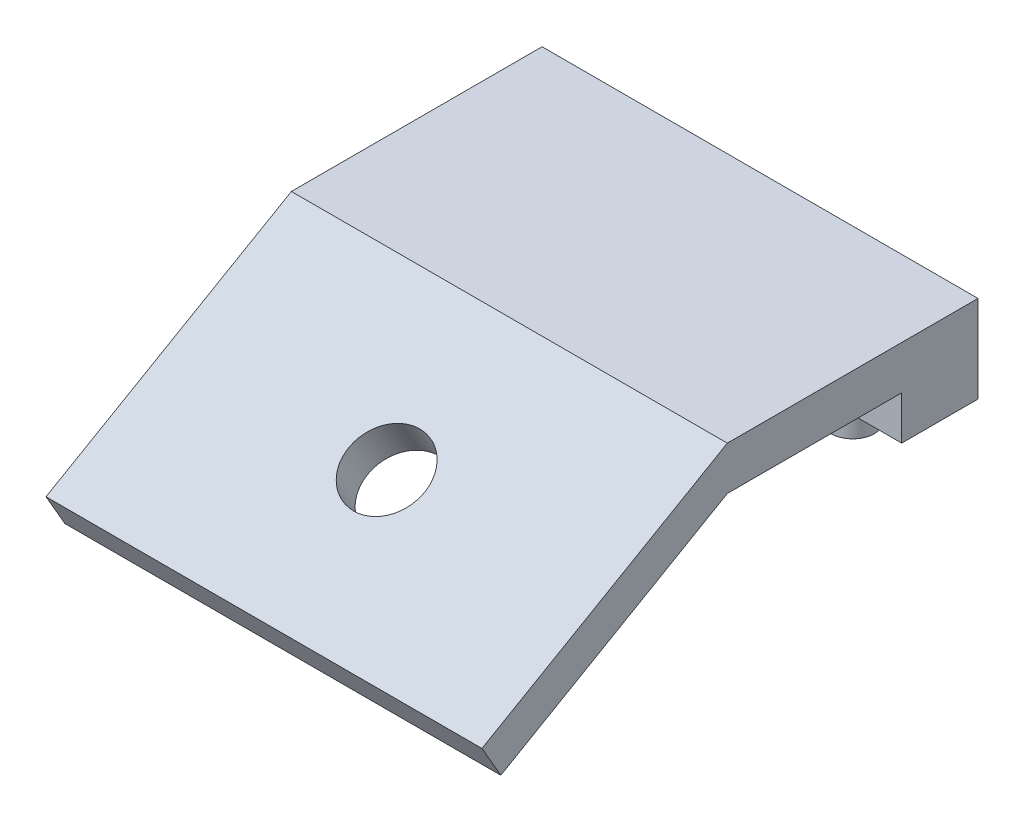
from build123d import *

# Parameters (mm, degrees)
CROQUIS1_W                          = 20
CROQUIS1_H                          = 3.5
SALIENTE_EXTRUIR1_DEPTH             = 4
CROQUIS2_R                          = 1
SALIENTE_EXTRUIR2_DEPTH             = 2
CROQUIS3_W                          = 20
CROQUIS3_H                          = 2
SALIENTE_EXTRUIR3_DEPTH             = 8
CROQUIS4_W                          = 20
CROQUIS4_H                          = 1.732050807
SALIENTE_EXTRUIR4_DEPTH             = 12
SALIENTE_EXTRUIR4_DIRECTION_2_REACH = 17.06
CROQUIS5_R                          = 1.75
CORTAR_EXTRUIR1_DEPTH               = 23.571551689


with BuildPart() as part:
    # Croquis1 → Saliente-Extruir1 (new body)
    with BuildSketch(Plane(origin=(0, 0, 0), x_dir=(1, 0, 0), z_dir=(0, 1, 0))):
        Rectangle(CROQUIS1_W, CROQUIS1_H)
    extrude(amount=SALIENTE_EXTRUIR1_DEPTH)

    # Croquis2 → Saliente-Extruir2 (add)
    with BuildSketch(Plane.XZ):
        with Locations(Location((0, 0, 0), (0, 0, 270))):
            Circle(CROQUIS2_R)
        with Locations(Location((-6, 0, 0), (0, 0, 90))):
            Circle(CROQUIS2_R)
        with Locations(Location((6, 0, 0), (0, 0, 90))):
            Circle(CROQUIS2_R)
    extrude(amount=SALIENTE_EXTRUIR2_DEPTH)

    # Croquis3 → Saliente-Extruir3 (add)
    with BuildSketch(Plane.XY.offset(1.75)):
        with Locations((0, 3)):
            Rectangle(CROQUIS3_W, CROQUIS3_H)
    extrude(amount=SALIENTE_EXTRUIR3_DEPTH)

    # Croquis4 → Saliente-Extruir4 (add)
    with BuildSketch(Plane(origin=(0, -3.721873843, 6.446474596), x_dir=(1, 0, 0), z_dir=(0, -0.500000000000001, 0.866025403784438))):
        with Locations((0, 7.473076212)):
            Rectangle(CROQUIS4_W, CROQUIS4_H)
    extrude(amount=SALIENTE_EXTRUIR4_DEPTH)

    # Croquis4 → Saliente-Extruir4 direction 2 (add, up to next)
    with BuildSketch(Plane(origin=(0, -3.721873843, 6.446474596), x_dir=(1, 0, 0), z_dir=(0, -0.500000000000001, 0.866025403784438)), mode=Mode.PRIVATE) as saliente_extruir4_direction_2_sk1:
        with Locations((0, 7.473076212)):
            Rectangle(CROQUIS4_W, CROQUIS4_H)
    saliente_extruir4_direction_2_tool1 = extrude(saliente_extruir4_direction_2_sk1.sketch, amount=-SALIENTE_EXTRUIR4_DIRECTION_2_REACH, mode=Mode.PRIVATE) - part.part
    add(saliente_extruir4_direction_2_tool1.solids().sort_by_distance((0, 2.75, 10.183013))[0])

    # Croquis5 → Cortar-Extruir1 (cut, through all)
    with BuildSketch(Plane(origin=(0, 7.221873843, 4.169550808), x_dir=(1, 0, 0), z_dir=(0, 0.8660254037844382, 0.500000000000001))):
        with Locations(Location((0, -12.943747687, 0), (0, 0, 270))):
            Circle(CROQUIS5_R)
    extrude(amount=-CORTAR_EXTRUIR1_DEPTH, mode=Mode.SUBTRACT)


solid = part.part
